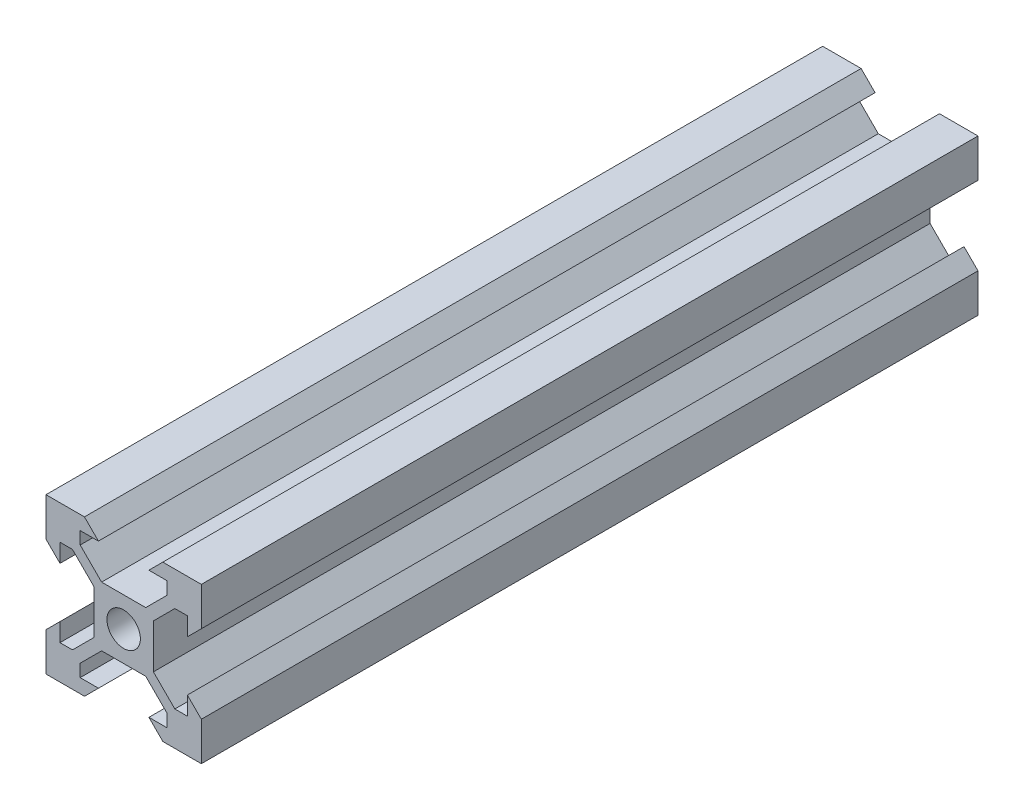
from build123d import *

# Parameters (mm, degrees)
CROQUIS1_R              = 1.075
SALIENTE_EXTRUIR1_DEPTH = 50


with BuildPart() as part:
    # Croquis1 → Saliente-Extruir1 (new body)
    with BuildSketch(Plane.XY):
        Polygon((-1.420025253, 1.915), (-2.8, 3.294974747), (-2.8, 4.1), (-1.625, 4.1), (-2.525, 5), (-5, 5), (-5, 2.52), (-4.1, 1.62), (-4.1, 2.8), (-3.294974747, 2.8), (-1.915, 1.420025253), (-1.915, -1.420025253), (-3.294974747, -2.8), (-4.1, -2.8), (-4.1, -1.625), (-5, -2.525), (-5, -5), (-2.52, -5), (-1.62, -4.1), (-2.8, -4.1), (-2.8, -3.294974747), (-1.420025253, -1.915), (1.420025253, -1.915), (2.8, -3.294974747), (2.8, -4.1), (1.625, -4.1), (2.525, -5), (5, -5), (5, -2.52), (4.1, -1.62), (4.1, -2.8), (3.294974747, -2.8), (1.915, -1.420025253), (1.915, 1.420025253), (3.294974747, 2.8), (4.1, 2.8), (4.1, 1.625), (5, 2.525), (5, 5), (2.52, 5), (1.62, 4.1), (2.8, 4.1), (2.8, 3.294974747), (1.420025253, 1.915), align=None)
        Circle(CROQUIS1_R, mode=Mode.SUBTRACT)
    extrude(amount=SALIENTE_EXTRUIR1_DEPTH)


solid = part.part
